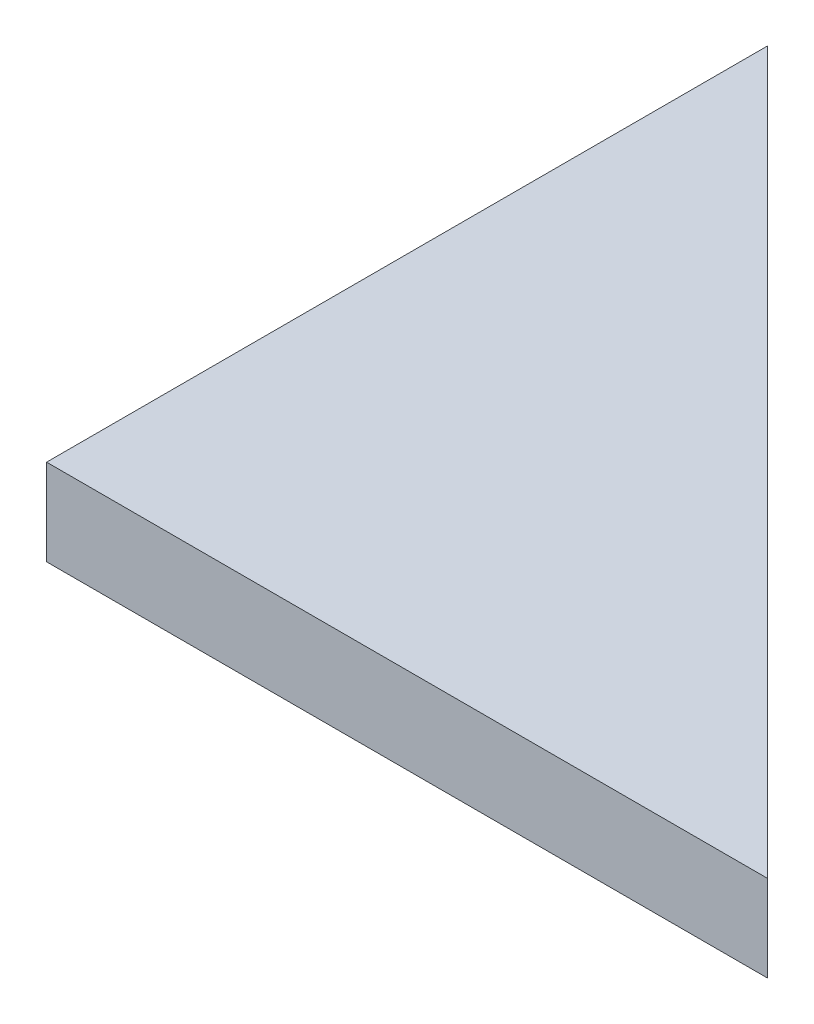
from build123d import *

# Parameters (mm, degrees)
BOSS_EXTRUDE1_DEPTH = 18.25625


with BuildPart() as part:
    # Sketch1 → Boss-Extrude1 (new body)
    with BuildSketch(Plane(origin=(0, 0, 0), x_dir=(1, 0, 0), z_dir=(0, 1, 0))):
        Polygon((0, 0), (0, 152.4), (152.4, 0), align=None)
    extrude(amount=BOSS_EXTRUDE1_DEPTH)


solid = part.part
